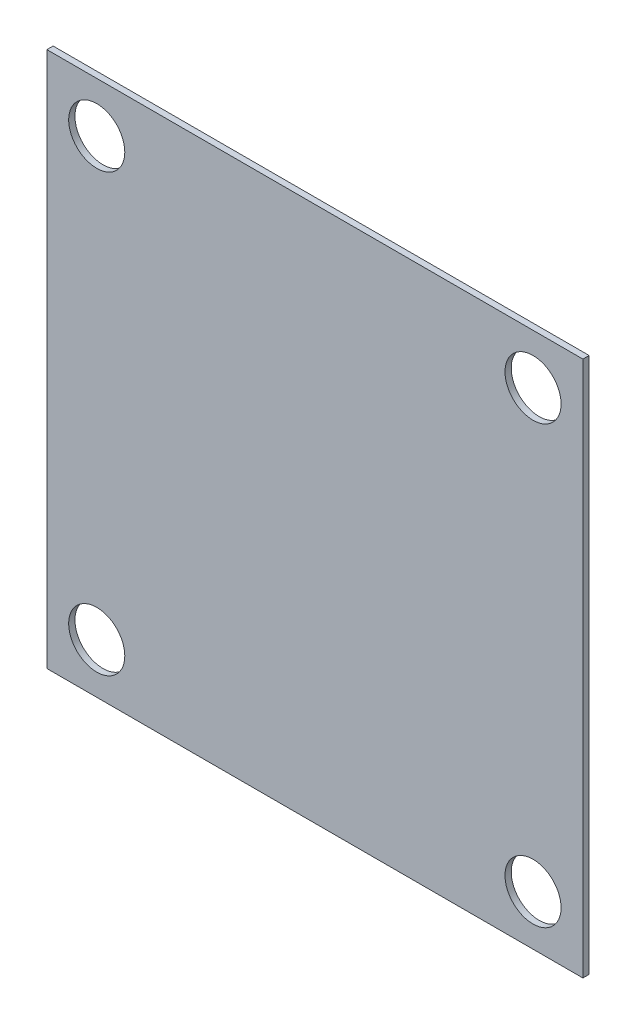
from build123d import *

# Parameters (mm, degrees)
SKETCH1_W           = 86
SKETCH1_H           = 86
SKETCH1_R           = 4.5
BOSS_EXTRUDE1_DEPTH = 1


with BuildPart() as part:
    # Sketch1 → Boss-Extrude1 (new body)
    with BuildSketch(Plane.XY):
        Rectangle(SKETCH1_W, SKETCH1_H)
        with Locations((35, 35)):
            Circle(SKETCH1_R, mode=Mode.SUBTRACT)
        with Locations((35, -35)):
            Circle(SKETCH1_R, mode=Mode.SUBTRACT)
        with Locations((-35, 35)):
            Circle(SKETCH1_R, mode=Mode.SUBTRACT)
        with Locations((-35, -35)):
            Circle(SKETCH1_R, mode=Mode.SUBTRACT)
    extrude(amount=BOSS_EXTRUDE1_DEPTH)


solid = part.part
